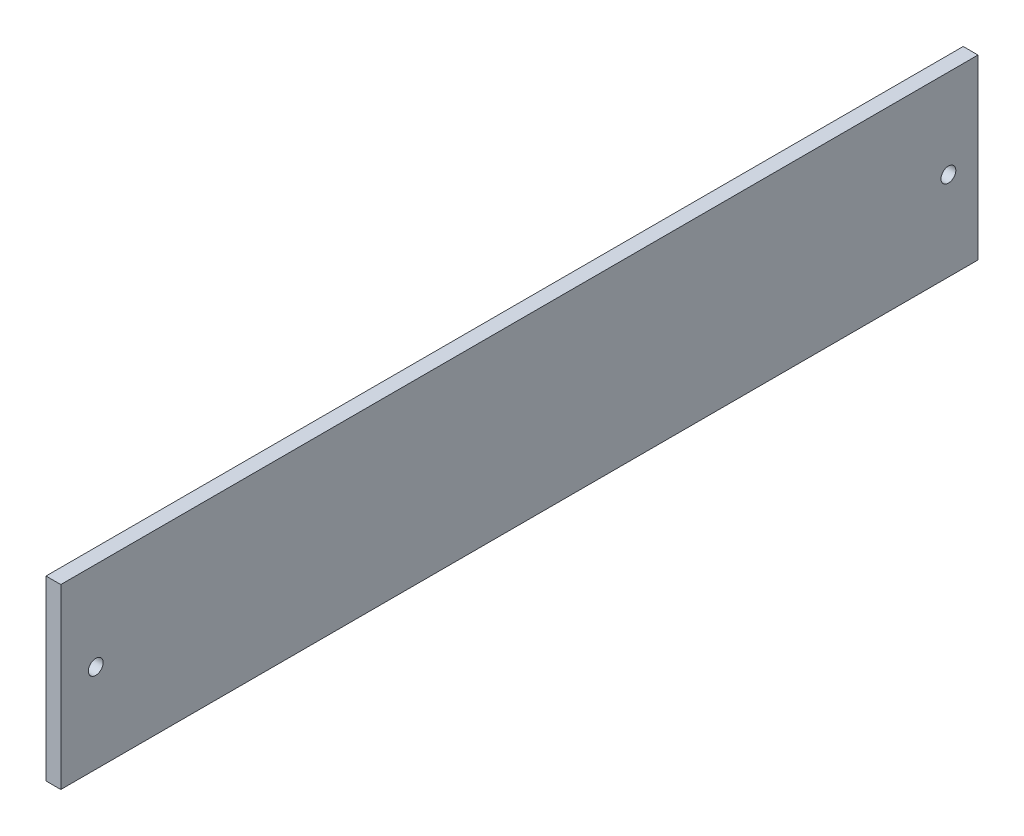
from build123d import *

# Parameters (mm, degrees)
SKETCH3_W           = 393.7
SKETCH3_H           = 76.2
BOSS_EXTRUDE1_DEPTH = 6.35
SKETCH4_R           = 3.175
CUT_EXTRUDE1_DEPTH  = 6.35
SKETCH6_R           = 3.175
CUT_EXTRUDE3_DEPTH  = 6.35


with BuildPart() as part:
    # Sketch3 → Boss-Extrude1 (new body)
    with BuildSketch(Plane(origin=(0, 0, 0), x_dir=(0, 0, -1), z_dir=(1, 0, 0))):
        Rectangle(SKETCH3_W, SKETCH3_H)
    extrude(amount=BOSS_EXTRUDE1_DEPTH)

    # Sketch4 → Cut-Extrude1 (cut)
    with BuildSketch(Plane.ZY):
        with Locations((181.85, 0)):
            Circle(SKETCH4_R)
    extrude(amount=-CUT_EXTRUDE1_DEPTH, mode=Mode.SUBTRACT)

    # Sketch6 → Cut-Extrude3 (cut)
    with BuildSketch(Plane.ZY):
        with Locations((-184.15, 0)):
            Circle(SKETCH6_R)
    extrude(amount=-CUT_EXTRUDE3_DEPTH, mode=Mode.SUBTRACT)


solid = part.part
